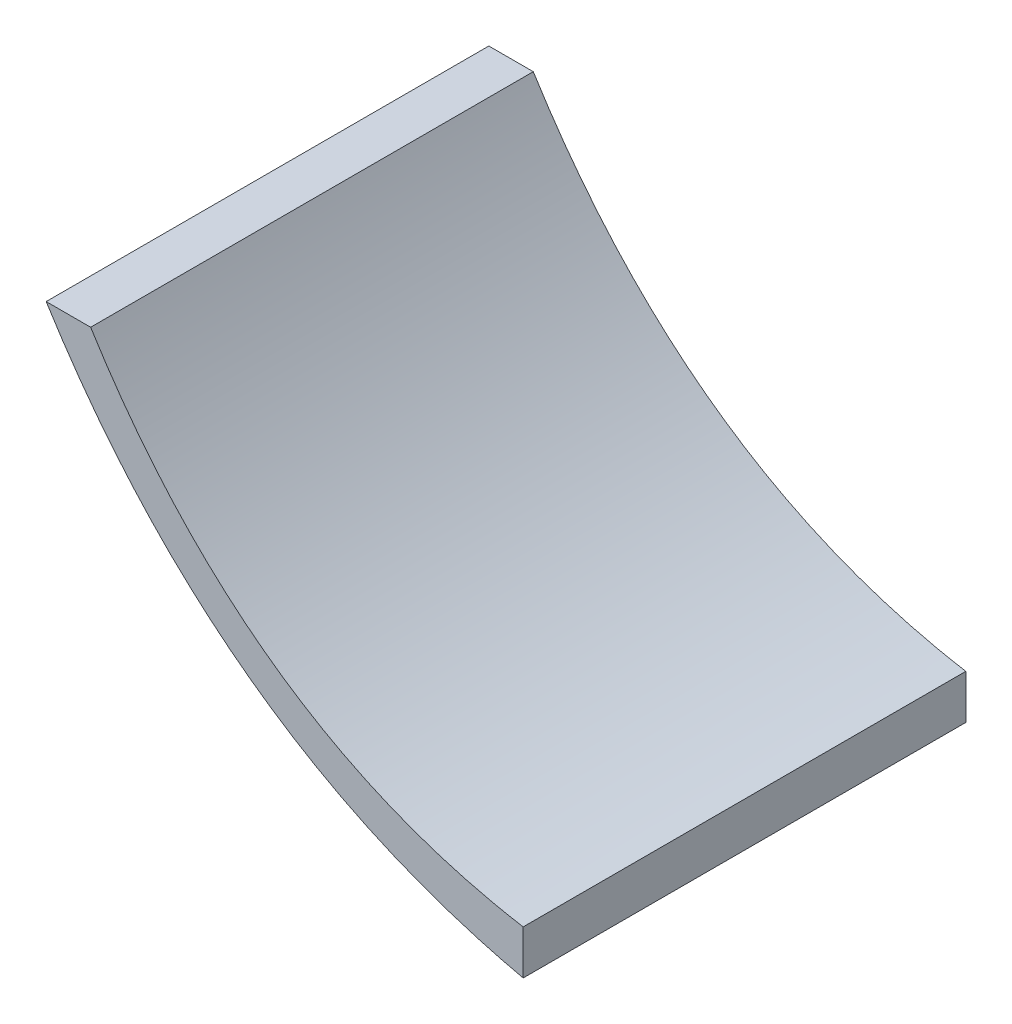
from build123d import *

# Parameters (mm, degrees)
BOSS_EXTRUDE1_DEPTH = 63.5


with BuildPart() as part:
    # Sketch1 → Boss-Extrude1 (new, symmetric)
    with BuildSketch(Plane.XY):
        with BuildLine():
            Line((-124.10088452, 84.263750928), (-136.857511415, 84.263750928))
            add(Edge.make_bspline(
                [(-136.857511415, 84.263750928), (-86.857146787, 4.126444198), (0, -15.381825942)],
                knots=[0, 0, 0, 1, 1, 1], degree=2))
            Line((0, -15.381825942), (0, -2.681825942))
            add(Edge.make_bspline(
                [(-124.10088452, 84.263750928), (-78.316961973, 10.657955133), (0, -2.681825942)],
                knots=[0, 0, 0, 1, 1, 1], degree=2))
        make_face()
    extrude(amount=BOSS_EXTRUDE1_DEPTH, both=True)


solid = part.part
